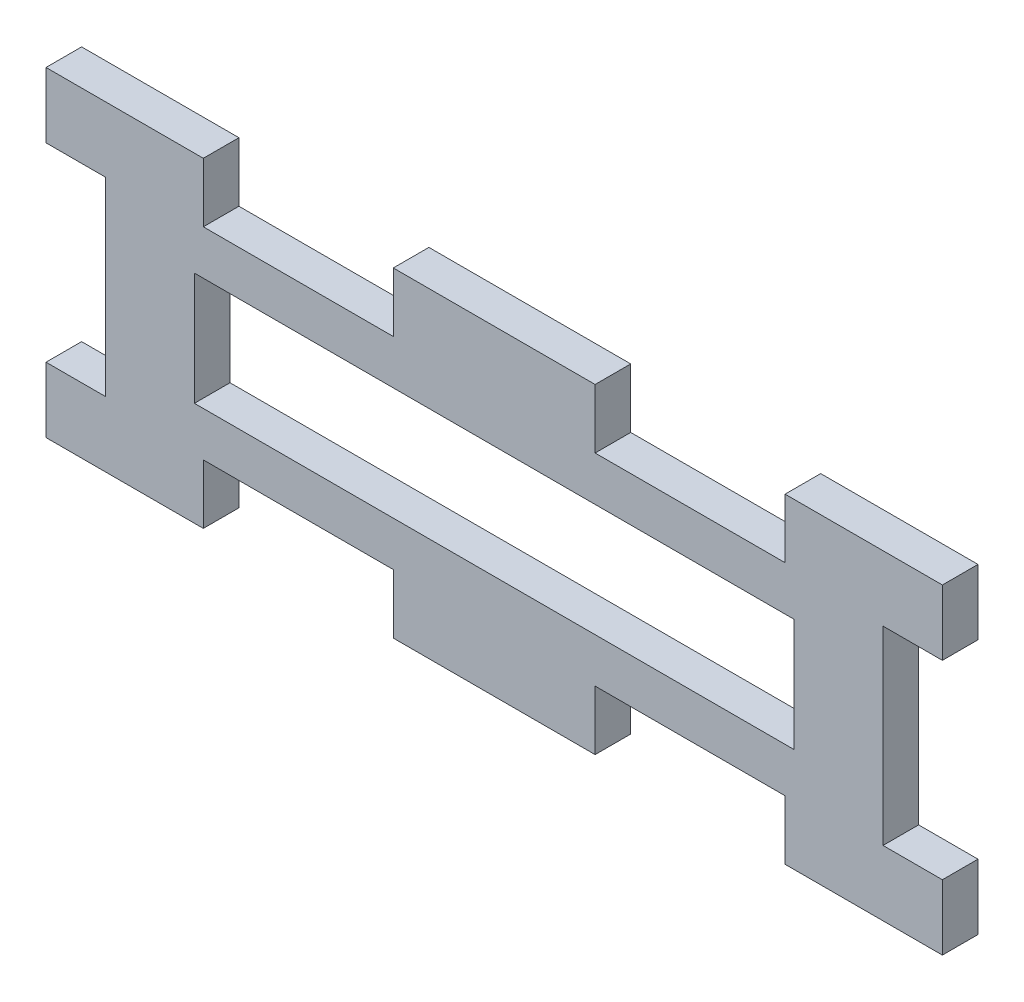
from build123d import *

# Parameters (mm, degrees)
ESQUISSE1_W             = 151
ESQUISSE1_H             = 54
ESQUISSE1_W_2           = 101
ESQUISSE1_H_2           = 19
BOSS_EXTRU_1_DEPTH      = 6
ESQUISSE2_W             = 10
ESQUISSE2_H             = 32
ENL_V_MAT_EXTRU_1_DEPTH = 6
ESQUISSE4_W             = 32
ESQUISSE4_H             = 10
ENL_V_MAT_EXTRU_2_DEPTH = 10


with BuildPart() as part:
    # Esquisse1 → Boss.-Extru.1 (new body)
    with BuildSketch(Plane.XY):
        Rectangle(ESQUISSE1_W, ESQUISSE1_H)
        Rectangle(ESQUISSE1_W_2, ESQUISSE1_H_2, mode=Mode.SUBTRACT)
    extrude(amount=-BOSS_EXTRU_1_DEPTH)

    # Esquisse2 → Enlèv. mat.-Extru.1 (cut)
    with BuildSketch(Plane.XY):
        with Locations((-70.5, 0)):
            Rectangle(ESQUISSE2_W, ESQUISSE2_H)
        with Locations((70.5, 0)):
            Rectangle(ESQUISSE2_W, ESQUISSE2_H)
    extrude(amount=-ENL_V_MAT_EXTRU_1_DEPTH, mode=Mode.SUBTRACT)

    # Esquisse4 → Enlèv. mat.-Extru.2 (cut)
    with BuildSketch(Plane.XY):
        with Locations((33, 22)):
            Rectangle(ESQUISSE4_W, ESQUISSE4_H)
        with Locations((-33, 22)):
            Rectangle(ESQUISSE4_W, ESQUISSE4_H)
        with Locations((-33, -22)):
            Rectangle(ESQUISSE4_W, ESQUISSE4_H)
        with Locations((33, -22)):
            Rectangle(ESQUISSE4_W, ESQUISSE4_H)
    extrude(amount=-ENL_V_MAT_EXTRU_2_DEPTH, mode=Mode.SUBTRACT)


solid = part.part
